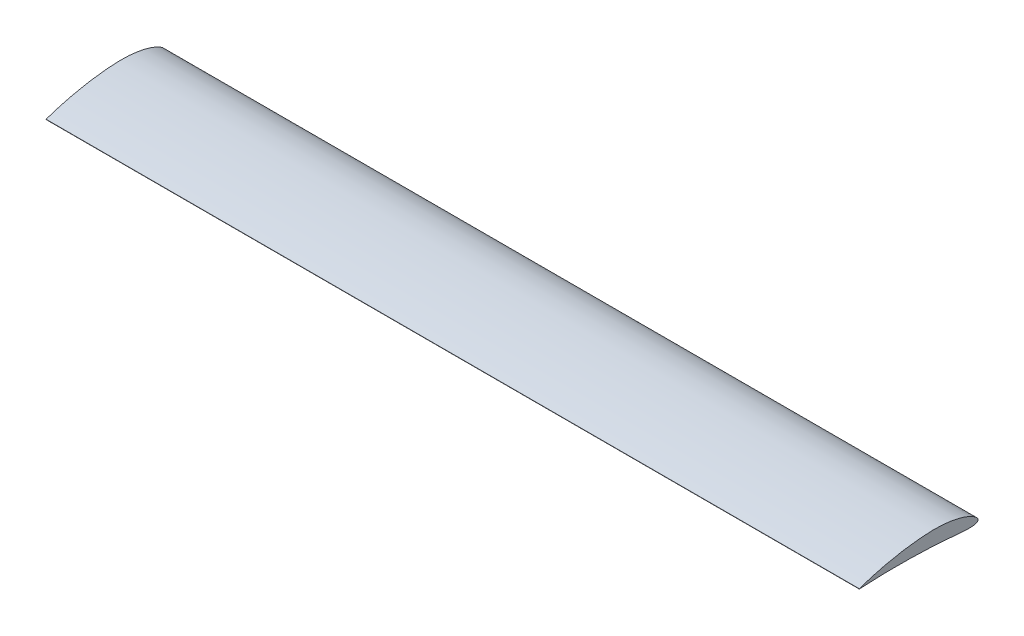
from build123d import *

# Parameters (mm, degrees)
BOSS_EXTRUDE1_DEPTH = 2438.4


with BuildPart() as part:
    # Sketch1 → Boss-Extrude1 (new body)
    with BuildSketch(Plane(origin=(0, 0, 0), x_dir=(0, 0, -1), z_dir=(1, 0, 0))):
        with BuildLine():
            ThreePointArc((-355.685838538, 0.439352538), (-356.037320538, -0.087870538), (-355.510097462, -0.439352538))
            add(Edge.make_bspline(
                [(0, 0), (-0.019755379, -0.063391982), (-0.059240074, -0.190092318), (-0.127313648, -0.377161852), (-0.201769084, -0.561755473), (-0.283236218, -0.74368145), (-0.401229555, -0.983296704), (-0.532864624, -1.217282066), (-0.677543161, -1.445163358), (-0.832473481, -1.671286592), (-1.000545371, -1.891211021), (-1.181014592, -2.104704238), (-1.323840021, -2.263065241), (-1.473467467, -2.418775062), (-1.629772428, -2.57213213), (-1.793319109, -2.722159443), (-1.962660756, -2.870625659), (-2.139206926, -3.015766682), (-2.322378983, -3.158581452), (-2.577700473, -3.347063464), (-2.844424509, -3.528754809), (-3.194286782, -3.749647806), (-3.487516586, -3.921075405), (-3.87041086, -4.129199294), (-4.273424465, -4.332572718), (-4.779036443, -4.56441261), (-5.310673724, -4.786205952), (-5.868206692, -4.998019105), (-6.451502181, -5.199920521), (-7.060423141, -5.391981083), (-7.694828766, -5.574273809), (-8.354574206, -5.74687486), (-9.039510887, -5.909862812), (-9.749486421, -6.063319275), (-10.484344769, -6.20732884), (-11.243926274, -6.341979224), (-12.028067851, -6.4673611), (-12.836603017, -6.583568456), (-13.66936209, -6.690698218), (-14.526172247, -6.788850646), (-15.406857662, -6.878129048), (-16.31123962, -6.958640174), (-17.239136645, -7.030493597), (-18.190364599, -7.093802197), (-19.164736783, -7.148682088), (-20.16206409, -7.195252426), (-21.358661642, -7.240276654), (-22.763722734, -7.278061209), (-24.386173154, -7.302658468), (-26.058058906, -7.310017196), (-27.778700039, -7.300603249), (-29.547408306, -7.274896412), (-31.363487585, -7.233391245), (-33.226234683, -7.176596507), (-35.134940043, -7.105035392), (-37.088888391, -7.019244258), (-39.087359371, -6.919773368), (-41.129628137, -6.807185763), (-43.214965874, -6.682057154), (-45.586844074, -6.529242304), (-48.254867836, -6.344866418), (-51.228290195, -6.125661597), (-54.272159796, -5.889226207), (-57.384715875, -5.637079142), (-60.564193309, -5.370767872), (-63.808823241, -5.091867655), (-67.116833543, -4.801978051), (-70.486449005, -4.502720522), (-74.209527362, -4.169451104), (-78.29454954, -3.802629564), (-82.749507202, -3.404206202), (-87.288167166, -3.002845032), (-91.90701073, -2.60183537), (-96.60249801, -2.204460215), (-101.371063284, -1.813987503), (-106.209109348, -1.433654819), (-111.446368952, -1.041708554), (-117.426012731, -0.622218912), (-122.111186005, -0.322797403), (-125.146979621, -0.141815347), (-126.167245196, -0.082095276), (-127.189546509, -0.023435517), (-128.213843599, 0.034283518), (-129.240117255, 0.090835741), (-130.956837052, 0.18354184), (-133.715726858, 0.325998836), (-136.479825969, 0.456967055), (-138.560020735, 0.548905086), (-139.604254418, 0.59372619), (-140.650109711, 0.637202423), (-141.70180636, 0.679738074), (-142.763905763, 0.720517464), (-143.836304943, 0.761052845), (-144.914670884, 0.801872229), (-146.716396008, 0.869830095), (-151.061650177, 1.032840465), (-157.23713556, 1.259727835), (-164.895162658, 1.52950338), (-172.22077764, 1.774752194), (-179.928168038, 2.015255375), (-187.639045381, 2.235650537), (-195.33909101, 2.433192185), (-203.013884498, 2.605584508), (-210.648931172, 2.750997621), (-218.585447663, 2.873571047), (-226.799510906, 2.967469901), (-235.264813686, 3.026796008), (-243.596915389, 3.04760479), (-252.103601004, 3.03014609), (-260.745132453, 2.970752325), (-269.479132859, 2.866635157), (-278.226790301, 2.719214681), (-287.210964758, 2.522670431), (-296.599309611, 2.267632404), (-305.95875748, 1.962682655), (-315.318240828, 1.60917752), (-324.586308344, 1.212601957), (-333.756838845, 0.774349316), (-340.580305667, 0.416689027), (-344.520845505, 0.199377251), (-345.697326662, 0.13358986), (-346.188737773, 0.105976064), (-346.547099145, 0.085780346), (-346.898636202, 0.06589224), (-347.243338834, 0.046393172), (-347.581172094, 0.027008155), (-347.912153544, 0.008292862), (-348.236240283, -0.010237967), (-348.55341335, -0.028633757), (-348.863695423, -0.046247632), (-349.167029501, -0.063790141), (-349.557584686, -0.086337725), (-350.362943782, -0.133056694), (-351.94286823, -0.225456384), (-353.756150238, -0.33331537), (-355.064341864, -0.412303097), (-355.499240064, -0.438693661), (-355.510097462, -0.439352538)],
                knots=[0, 0, 0, 0, 0.000555944, 0.001111155, 0.001666387, 0.002222392, 0.002779916, 0.003902459, 0.004468917, 0.005039764, 0.006197308, 0.006785293, 0.00738024, 0.007982733, 0.008593332, 0.009213542, 0.009840934, 0.01047895, 0.011127055, 0.01178568, 0.013136101, 0.013828644, 0.015250096, 0.015979624, 0.017477683, 0.019029404, 0.020636545, 0.022300627, 0.02402296, 0.025804662, 0.02764668, 0.029549813, 0.031514721, 0.033541947, 0.035631924, 0.037784987, 0.040001387, 0.042281295, 0.04462481, 0.047031969, 0.049502751, 0.052037081, 0.054634838, 0.057295854, 0.060019925, 0.062806806, 0.065656221, 0.070046913, 0.074576451, 0.079243547, 0.084046801, 0.08898471, 0.094055679, 0.099258033, 0.104590021, 0.110049828, 0.115635582, 0.121345356, 0.127177177, 0.133129029, 0.141247994, 0.14957174, 0.158095222, 0.166813318, 0.175720845, 0.184812565, 0.1940832, 0.203527433, 0.213139921, 0.225383965, 0.237872004, 0.250593492, 0.263537855, 0.276694502, 0.290052828, 0.303602207, 0.317331996, 0.334030858, 0.3537971, 0.356644231, 0.359496949, 0.362355166, 0.365218802, 0.368087757, 0.370961955, 0.379615119, 0.391220737, 0.394133712, 0.39705114, 0.399972932, 0.402899, 0.405864975, 0.408873231, 0.411885411, 0.414901404, 0.423971147, 0.448297057, 0.466648223, 0.488137276, 0.509674226, 0.531219312, 0.552732506, 0.574173586, 0.595502201, 0.616677938, 0.640639767, 0.664289005, 0.68756579, 0.710410702, 0.735521789, 0.759929248, 0.783551965, 0.808782629, 0.835178185, 0.862196291, 0.887197561, 0.913607759, 0.939875492, 0.964076657, 0.970824036, 0.972922703, 0.973943601, 0.974945479, 0.975928291, 0.97689199, 0.977836546, 0.978761874, 0.979667972, 0.980554798, 0.981422263, 0.982270377, 0.983099084, 0.984698119, 0.989025587, 0.996351574, 0.999908916, 1, 1, 1, 1], degree=3))
            add(Edge.make_bspline(
                [(0, 0), (0.018401648, 0.063798126), (0.05518073, 0.191310427), (0.101307259, 0.384964794), (0.140711492, 0.580073882), (0.172746086, 0.776827514), (0.205926936, 1.041889377), (0.224457263, 1.309788132), (0.228518311, 1.57978454), (0.224306484, 1.784499201), (0.208912995, 2.06101203), (0.178866768, 2.339411058), (0.13468422, 2.619104984), (0.094063769, 2.831662655), (0.046143064, 3.045766557), (-0.009053429, 3.261417881), (-0.071586752, 3.478592146), (-0.141402044, 3.697297363), (-0.245116882, 3.993424457), (-0.362820691, 4.290108118), (-0.527990156, 4.664756372), (-0.674949287, 4.967317442), (-0.87670641, 5.349244617), (-1.052931327, 5.657547288), (-1.291291409, 6.046565638), (-1.550558509, 6.44258679), (-1.888150171, 6.918967216), (-2.255001996, 7.400645963), (-2.651105296, 7.887489091), (-3.076446838, 8.379353894), (-3.531009017, 8.876088634), (-4.014769458, 9.377532899), (-4.52770065, 9.883518015), (-5.069770082, 10.393867065), (-5.640939976, 10.908395226), (-6.24116713, 11.426910127), (-6.870402997, 11.949211896), (-7.52859356, 12.475093429), (-8.215679182, 13.004340793), (-8.931594574, 13.536733312), (-9.676268958, 14.072043651), (-10.449625619, 14.610038433), (-11.25158227, 15.150478016), (-12.082050624, 15.693117146), (-12.940936658, 16.237704835), (-13.82814034, 16.783984865), (-14.743555807, 17.331695692), (-15.687071047, 17.880571123), (-16.826731718, 18.525503787), (-18.175724606, 19.263251072), (-19.747456954, 20.089238819), (-21.380929224, 20.914709644), (-23.075634853, 21.738680982), (-24.831035898, 22.56015451), (-26.646562119, 23.378118426), (-28.52161085, 24.191549899), (-30.455546925, 24.999416816), (-32.447702847, 25.800679364), (-34.49737836, 26.594292896), (-36.603840701, 27.37920952), (-38.766324725, 28.154379879), (-41.238788712, 29.006562699), (-44.035827758, 29.92657486), (-47.171706516, 30.903416526), (-50.400057074, 31.854317564), (-53.718626928, 32.776871778), (-57.125067879, 33.668712749), (-60.616937203, 34.527522846), (-64.191700588, 35.351040737), (-67.846734793, 36.137069204), (-71.899059442, 36.947418072), (-76.360551748, 37.764825416), (-81.241862633, 38.569888557), (-86.228561132, 39.302471635), (-91.314682258, 39.959230476), (-96.494110884, 40.537078645), (-101.760595601, 41.033203196), (-107.471452811, 41.473090681), (-112.526095092, 41.767772821), (-116.165514974, 41.925048138), (-118.000176395, 41.992082459), (-119.105796127, 42.028783958), (-120.213803585, 42.06188221), (-121.324145905, 42.091313172), (-122.436767283, 42.117265469), (-123.551622517, 42.138984767), (-124.668600274, 42.159247674), (-125.787772219, 42.167618518), (-126.909232061, 42.154263387), (-128.032005717, 42.19941876), (-129.157425431, 42.193134776), (-130.28447125, 42.195983253), (-131.413415664, 42.19168677), (-132.54414341, 42.184610239), (-133.676616914, 42.173574582), (-134.810777708, 42.158890599), (-136.326259324, 42.134310876), (-137.843775232, 42.102294997), (-139.36322285, 42.062876918), (-140.505012449, 42.029511257), (-141.643908597, 41.992742141), (-142.775268506, 41.951885815), (-143.899100699, 41.908546832), (-145.019656003, 41.863301329), (-147.266937438, 41.768130114), (-151.022924253, 41.590962224), (-157.049982062, 41.255063299), (-164.229015364, 40.7745739), (-172.178280731, 40.14137032), (-180.131705875, 39.409132746), (-188.073054584, 38.581847058), (-195.986234468, 37.663974929), (-204.22638173, 36.613090679), (-212.768416838, 35.420601551), (-221.584703065, 34.079278137), (-230.630989643, 32.592489198), (-239.868248139, 30.957680921), (-249.254815511, 29.174553816), (-258.720713256, 27.25708126), (-267.900428826, 25.279381481), (-277.360448397, 23.123408108), (-286.689941088, 20.879555465), (-296.386117663, 18.418475967), (-305.241679185, 16.053839659), (-313.69874367, 13.694293361), (-321.613892736, 11.397673997), (-329.030283492, 9.158940104), (-336.687034437, 6.769182801), (-341.916764937, 5.078768034), (-345.271117037, 3.969845996), (-345.7656608, 3.805934182), (-346.126807231, 3.686023902), (-346.481422279, 3.568128657), (-346.829435287, 3.452094681), (-347.171048652, 3.338547258), (-347.50547541, 3.22528275), (-347.836644864, 3.119994215), (-348.152762421, 2.993900359), (-348.471655849, 2.897682717), (-348.77983412, 2.795206339), (-349.080357783, 2.691767087), (-349.377432831, 2.599430911), (-349.66494777, 2.500374892), (-349.946998853, 2.405586803), (-350.222184372, 2.312340282), (-350.49074144, 2.221394289), (-350.994426854, 2.050533148), (-351.831595275, 1.765789037), (-353.018769948, 1.359889654), (-354.325386153, 0.910543803), (-355.219109639, 0.601332948), (-355.675554441, 0.442921748), (-355.685838538, 0.439352538)],
                knots=[0, 0, 0, 0, 0.000533034, 0.001065367, 0.001597727, 0.002130842, 0.002665439, 0.003741957, 0.004285291, 0.004832931, 0.005385549, 0.006508312, 0.007079703, 0.007658563, 0.008245457, 0.008840924, 0.0094455, 0.010059662, 0.010683887, 0.011964293, 0.0126213, 0.013970819, 0.014664028, 0.016088934, 0.016821213, 0.018326744, 0.019888484, 0.021508124, 0.023187141, 0.024926827, 0.026728302, 0.028592536, 0.030520365, 0.032512501, 0.034569548, 0.036692011, 0.038880307, 0.041134773, 0.04345567, 0.045843197, 0.048297487, 0.050818622, 0.053406629, 0.056061489, 0.05878314, 0.061571476, 0.064426358, 0.067347606, 0.070335011, 0.074939626, 0.079691605, 0.084589875, 0.089633234, 0.094820367, 0.10014985, 0.105620155, 0.111229665, 0.116976669, 0.122859376, 0.128875916, 0.135024342, 0.141302642, 0.149872124, 0.158663675, 0.167672002, 0.176891637, 0.186316952, 0.195942165, 0.205761355, 0.215768468, 0.225957327, 0.238939387, 0.252183071, 0.265675627, 0.279404092, 0.293355314, 0.307515969, 0.321872586, 0.339340035, 0.348164827, 0.35111918, 0.354079727, 0.357046356, 0.360018957, 0.362997418, 0.365981627, 0.368971474, 0.371966638, 0.374967276, 0.377974156, 0.380985437, 0.384001798, 0.387023124, 0.390049306, 0.393080231, 0.396115786, 0.399155859, 0.40524911, 0.408302063, 0.411359084, 0.414420061, 0.417450628, 0.420448303, 0.42344964, 0.426454522, 0.438507144, 0.453638523, 0.474918327, 0.496272983, 0.51766145, 0.539042609, 0.560375349, 0.581618653, 0.60573481, 0.629620233, 0.653214912, 0.679337585, 0.704934088, 0.729922831, 0.756878323, 0.780324484, 0.80782051, 0.833916108, 0.860638882, 0.881408501, 0.904407441, 0.926807024, 0.943605084, 0.968805044, 0.970932919, 0.971969572, 0.972987977, 0.973988092, 0.974969876, 0.975933286, 0.976878284, 0.977804829, 0.978722392, 0.979608439, 0.980477636, 0.981329996, 0.982159972, 0.982975016, 0.983771354, 0.984548951, 0.985307775, 0.986047793, 0.98881921, 0.992407271, 0.996120931, 0.999912601, 1, 1, 1, 1], degree=3))
        make_face()
    extrude(amount=BOSS_EXTRUDE1_DEPTH)


solid = part.part
